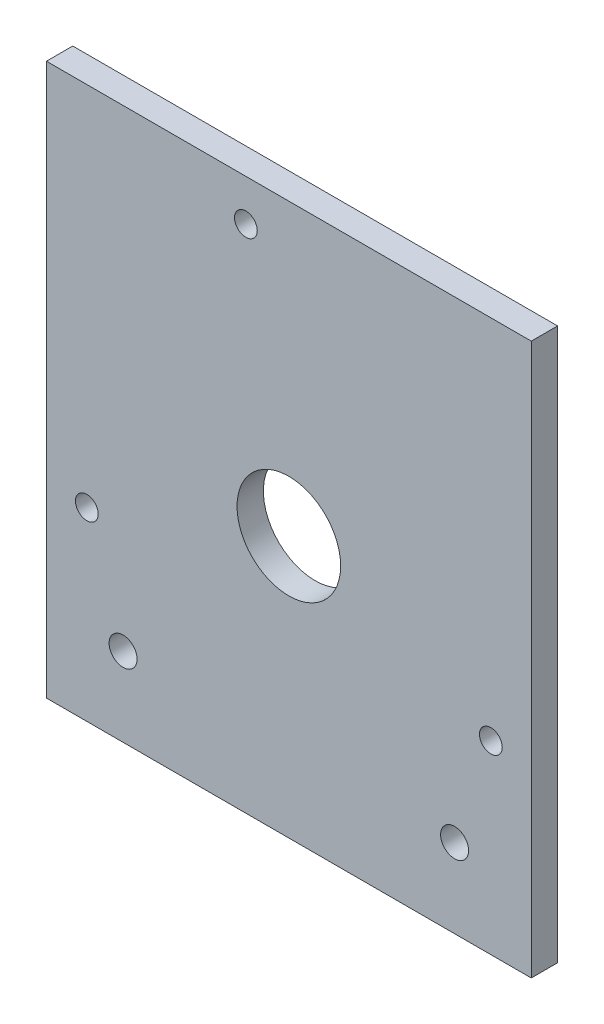
from build123d import *

# Parameters (mm, degrees)
SKETCH1_W           = 117
SKETCH1_H           = 133.1
SKETCH1_R           = 2.75
SKETCH1_R_2         = 3.38
SKETCH1_R_3         = 12.5
BOSS_EXTRUDE1_DEPTH = 6.35


with BuildPart() as part:
    # Sketch1 → Boss-Extrude1 (new body)
    with BuildSketch(Plane.XY):
        with Locations((0, 3.45)):
            Rectangle(SKETCH1_W, SKETCH1_H)
        with Locations((-48.75, -18.4)):
            Circle(SKETCH1_R, mode=Mode.SUBTRACT)
        with Locations((48.75, -18.4)):
            Circle(SKETCH1_R, mode=Mode.SUBTRACT)
        with Locations((-10.368974359, 60.010374765)):
            Circle(SKETCH1_R, mode=Mode.SUBTRACT)
        with Locations((-40, -44.05)):
            Circle(SKETCH1_R_2, mode=Mode.SUBTRACT)
        with Locations((40, -44.05)):
            Circle(SKETCH1_R_2, mode=Mode.SUBTRACT)
        Circle(SKETCH1_R_3, mode=Mode.SUBTRACT)
    extrude(amount=BOSS_EXTRUDE1_DEPTH)


solid = part.part
